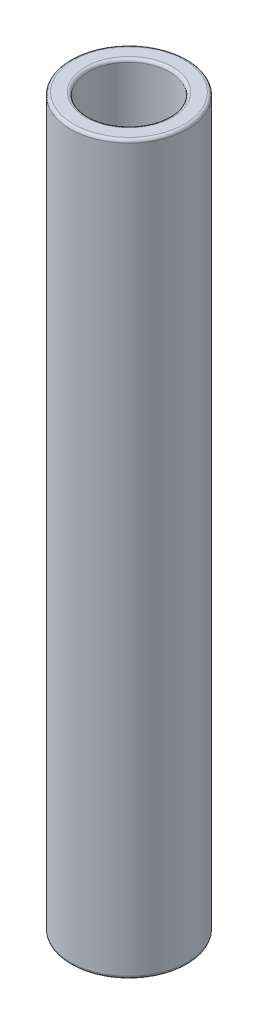
from build123d import *

# Parameters (mm, degrees)
SKETCH1_R                = 3.95
BOSS_EXTRUDE1_DEPTH      = 49.15
M5_CLEARANCE_HOLE1_D     = 5.5
M5_CLEARANCE_HOLE1_DEPTH = 49.15
M5_CLEARANCE_HOLE1_TIP   = 1.652366702
FILLET1_R                = 0.2


with BuildPart() as part:
    # Sketch1 → Boss-Extrude1 (new body)
    with BuildSketch(Plane(origin=(0, 0, 0), x_dir=(1, 0, 0), z_dir=(0, 1, 0))):
        Circle(SKETCH1_R)
    extrude(amount=BOSS_EXTRUDE1_DEPTH)

    # M5 Clearance Hole1
    with Locations(Plane(origin=(0, 49.15, 0), x_dir=(1, 0, 0), z_dir=(0, 1, 0))):
        with Locations((0, 0)):
            Hole(M5_CLEARANCE_HOLE1_D / 2, depth=M5_CLEARANCE_HOLE1_DEPTH)
            with Locations((0, 0, -(M5_CLEARANCE_HOLE1_DEPTH + M5_CLEARANCE_HOLE1_TIP / 2))):  # 118° drill point
                Cone(0, M5_CLEARANCE_HOLE1_D / 2, M5_CLEARANCE_HOLE1_TIP, mode=Mode.SUBTRACT)

    # Fillet1
    fillet1_edges = [part.edges().sort_by_distance(p)[0] for p in [
        (2.75, 0, 0),
        (-3.95, 0, 0),
        (-3.95, 49.15, 0),
        (2.75, 49.15, 0),
    ]]
    fillet(fillet1_edges, radius=FILLET1_R)


solid = part.part
